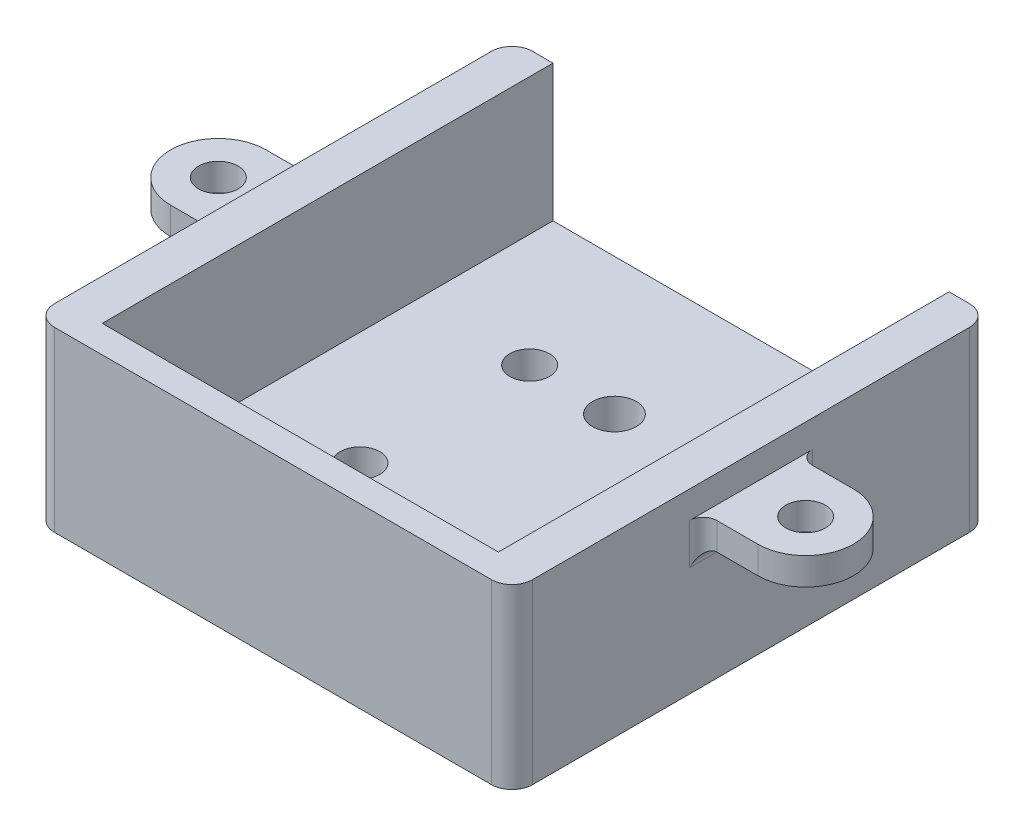
from build123d import *

# Parameters (mm, degrees)
SKETCH1_W           = 35
SKETCH1_H           = 35
SKETCH1_R           = 1.45
SKETCH1_R_2         = 1.6
BOSS_EXTRUDE1_DEPTH = 13
SHELL1_T            = -3
SKETCH2_W           = 29
SKETCH2_H           = 40.523208079
CUT_EXTRUDE1_DEPTH  = 10
FILLET1_R           = 1.5
SKETCH4_R           = 1.45
BOSS_EXTRUDE3_DEPTH = 2
FILLET2_R           = 1


with BuildPart() as part:
    # Sketch1 → Boss-Extrude1 (new body)
    with BuildSketch(Plane(origin=(0, 0, 0), x_dir=(1, 0, 0), z_dir=(0, 1, 0))):
        Rectangle(SKETCH1_W, SKETCH1_H)
        with Locations(Location((6.21, 7.5, 0), (0, 0, 90))):
            Circle(SKETCH1_R, mode=Mode.SUBTRACT)
        with Locations(Location((0, 7.5, 0), (0, 0, 90))):
            Circle(SKETCH1_R_2, mode=Mode.SUBTRACT)
        with Locations(Location((-6.21, 7.5, 0), (0, 0, 90))):
            Circle(SKETCH1_R, mode=Mode.SUBTRACT)
        with Locations(Location((-6.21, -4.92, 0), (0, 0, 90))):
            Circle(SKETCH1_R, mode=Mode.SUBTRACT)
        with Locations(Location((6.21, -4.92, 0), (0, 0, 90))):
            Circle(SKETCH1_R, mode=Mode.SUBTRACT)
        with Locations(Location((-6.21, -12.5, 0), (0, 0, 90))):
            Circle(SKETCH1_R_2, mode=Mode.SUBTRACT)
        with Locations(Location((6.21, -12.5, 0), (0, 0, 90))):
            Circle(SKETCH1_R_2, mode=Mode.SUBTRACT)
    extrude(amount=BOSS_EXTRUDE1_DEPTH)

    # Shell1
    shell1_openings = [part.faces().sort_by_distance(p)[0] for p in [
        (0, 13, -0.090817289),
    ]]
    offset(amount=SHELL1_T, openings=shell1_openings, kind=Kind.INTERSECTION)

    # Sketch2 → Cut-Extrude1 (cut)
    with BuildSketch(Plane(origin=(0, 13, 0), x_dir=(1, 0, 0), z_dir=(0, 1, 0))):
        with Locations((0, 4.76160404)):
            Rectangle(SKETCH2_W, SKETCH2_H)
    extrude(amount=-CUT_EXTRUDE1_DEPTH, mode=Mode.SUBTRACT)

    # Fillet1
    fillet1_edges = [part.edges().sort_by_distance(p)[0] for p in [
        (-17.5, 6.5, -17.5),
        (17.5, 6.5, -17.5),
        (17.5, 6.5, 17.5),
        (-17.5, 6.5, 17.5),
    ]]
    fillet(fillet1_edges, radius=FILLET1_R)

    # Sketch4 → Boss-Extrude3 (add)
    # profile 1 of 2: a face of its own
    with BuildSketch(Plane(origin=(0, 11, 0), x_dir=(1, 0, 0), z_dir=(0, 1, 0))):
        with BuildLine():
            Line((-17.5, -3.5), (-21.5, -3.5))
            ThreePointArc((-21.5, -3.5), (-25, 0), (-21.5, 3.5))
            Line((-21.5, 3.5), (-17.5, 3.5))
            Line((-17.5, 3.5), (-17.5, -3.5))
        make_face()
        with Locations(Location((-21.5, 0, 0), (0, 0, 270))):
            Circle(SKETCH4_R, mode=Mode.SUBTRACT)
    # profile 2 of 2: a face of its own
    with BuildSketch(Plane(origin=(0, 11, 0), x_dir=(1, 0, 0), z_dir=(0, 1, 0))):
        with BuildLine():
            Line((17.5, 3.5), (21.5, 3.5))
            ThreePointArc((21.5, 3.5), (25, 0), (21.5, -3.5))
            Line((21.5, -3.5), (17.5, -3.5))
            Line((17.5, -3.5), (17.5, 3.5))
        make_face()
        with Locations(Location((21.5, 0, 0), (0, 0, 270))):
            Circle(SKETCH4_R, mode=Mode.SUBTRACT)
    extrude(amount=-BOSS_EXTRUDE3_DEPTH)

    # Fillet2
    fillet2_edges = [part.edges().sort_by_distance(p)[0] for p in [
        (-17.5, 9, 0),
        (-17.5, 10, -3.5),
        (-17.5, 10, 3.5),
        (17.5, 9, 0),
        (17.5, 10, 3.5),
        (17.5, 10, -3.5),
    ]]
    fillet(fillet2_edges, radius=FILLET2_R)


solid = part.part
